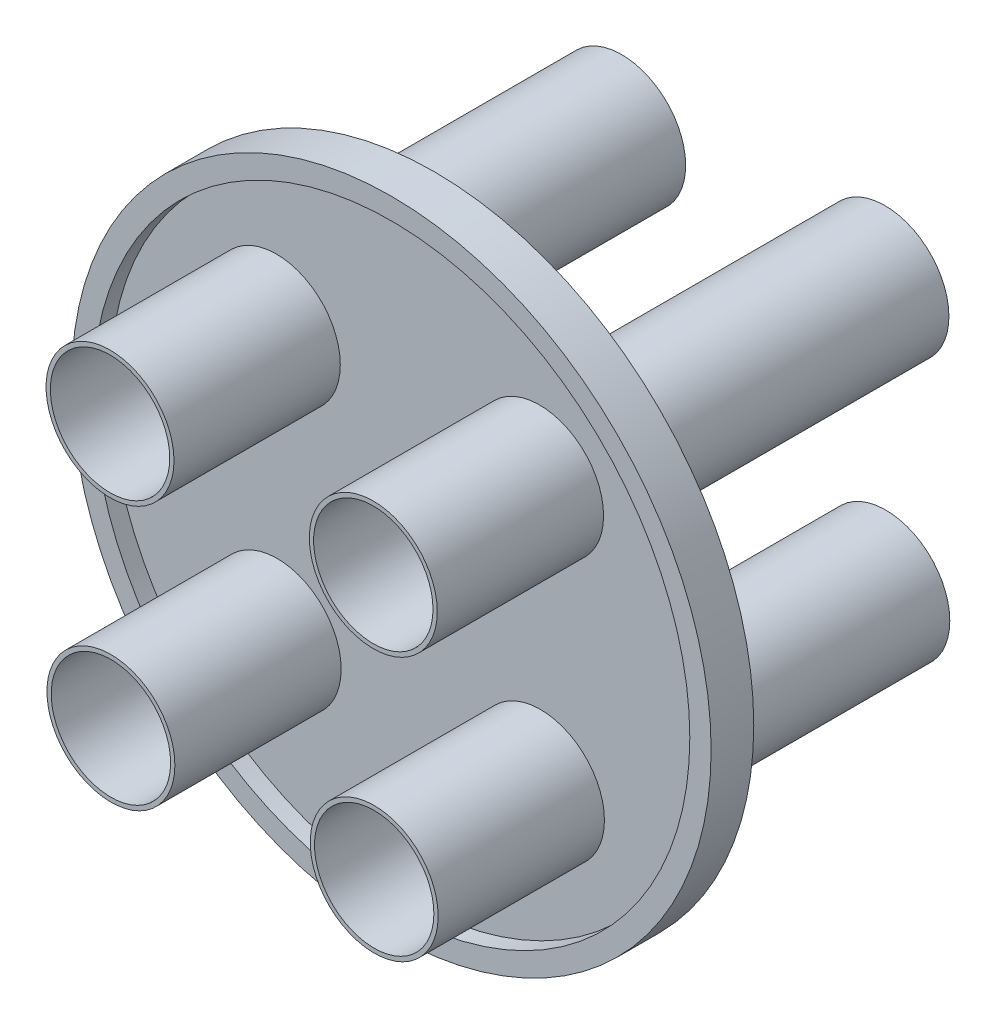
from build123d import *

# Parameters (mm, degrees)
BOSS_EXTRUDE1_DEPTH      = 2.5
BOSS_EXTRUDE1_DEPTH_BACK = 2.5
SKETCH1_R                = 37.5
SKETCH1_R_2              = 35
BOSS_EXTRUDE2_DEPTH      = 0.5
BOSS_EXTRUDE2_DEPTH_BACK = 0.5
SKETCH1_3_R              = 35
SKETCH1_3_R_2            = 7.5
SKETCH1_3_R_3            = 2.5
BOSS_EXTRUDE3_DEPTH      = 20
BOSS_EXTRUDE3_DEPTH_BACK = 40
SKETCH1_4_R              = 7.5
SKETCH1_4_R_2            = 7


with BuildPart() as part:
    # Sketch1 → Boss-Extrude1 (new, two sides: drawn at the far end of the back side and taken through both)
    with BuildSketch(Plane.XY.offset(-BOSS_EXTRUDE1_DEPTH_BACK)):
        Circle(SKETCH1_R)
        Circle(SKETCH1_R_2, mode=Mode.SUBTRACT)
    extrude(amount=BOSS_EXTRUDE1_DEPTH + BOSS_EXTRUDE1_DEPTH_BACK)

    # Sketch1<3> → Boss-Extrude2 (add, two sides: drawn at the far end of the back side and taken through both)
    with BuildSketch(Plane.XY.offset(-BOSS_EXTRUDE2_DEPTH_BACK)):
        Circle(SKETCH1_3_R)
        with Locations((-15.384748909, -15.487184505)):
            Circle(SKETCH1_3_R_2, mode=Mode.SUBTRACT)
        with Locations((15.487184505, -15.384748909)):
            Circle(SKETCH1_3_R_2, mode=Mode.SUBTRACT)
        with Locations((-15.487184505, 15.384748909)):
            Circle(SKETCH1_3_R_2, mode=Mode.SUBTRACT)
        Circle(SKETCH1_3_R_3, mode=Mode.SUBTRACT)
        with Locations((15.384748909, 15.487184505)):
            Circle(SKETCH1_3_R_2, mode=Mode.SUBTRACT)
    extrude(amount=BOSS_EXTRUDE2_DEPTH + BOSS_EXTRUDE2_DEPTH_BACK)

    # Sketch1<4> → Boss-Extrude3 (add, two sides: drawn at the far end of the back side and taken through both)
    # profile 1 of 4: a face of its own
    with BuildSketch(Plane.XY.offset(-BOSS_EXTRUDE3_DEPTH_BACK)):
        with Locations((-15.487184505, 15.384748909)):
            Circle(SKETCH1_4_R)
        with Locations((-15.487184505, 15.384748909)):
            Circle(SKETCH1_4_R_2, mode=Mode.SUBTRACT)
    # profile 2 of 4: a face of its own
    with BuildSketch(Plane.XY.offset(-BOSS_EXTRUDE3_DEPTH_BACK)):
        with Locations((15.384748909, 15.487184505)):
            Circle(SKETCH1_4_R)
        with Locations((15.384748909, 15.487184505)):
            Circle(SKETCH1_4_R_2, mode=Mode.SUBTRACT)
    # profile 3 of 4: a face of its own
    with BuildSketch(Plane.XY.offset(-BOSS_EXTRUDE3_DEPTH_BACK)):
        with Locations((15.487184505, -15.384748909)):
            Circle(SKETCH1_4_R)
        with Locations((15.487184505, -15.384748909)):
            Circle(SKETCH1_4_R_2, mode=Mode.SUBTRACT)
    # profile 4 of 4: a face of its own
    with BuildSketch(Plane.XY.offset(-BOSS_EXTRUDE3_DEPTH_BACK)):
        with Locations((-15.384748909, -15.487184505)):
            Circle(SKETCH1_4_R)
        with Locations((-15.384748909, -15.487184505)):
            Circle(SKETCH1_4_R_2, mode=Mode.SUBTRACT)
    extrude(amount=BOSS_EXTRUDE3_DEPTH + BOSS_EXTRUDE3_DEPTH_BACK)


solid = part.part
